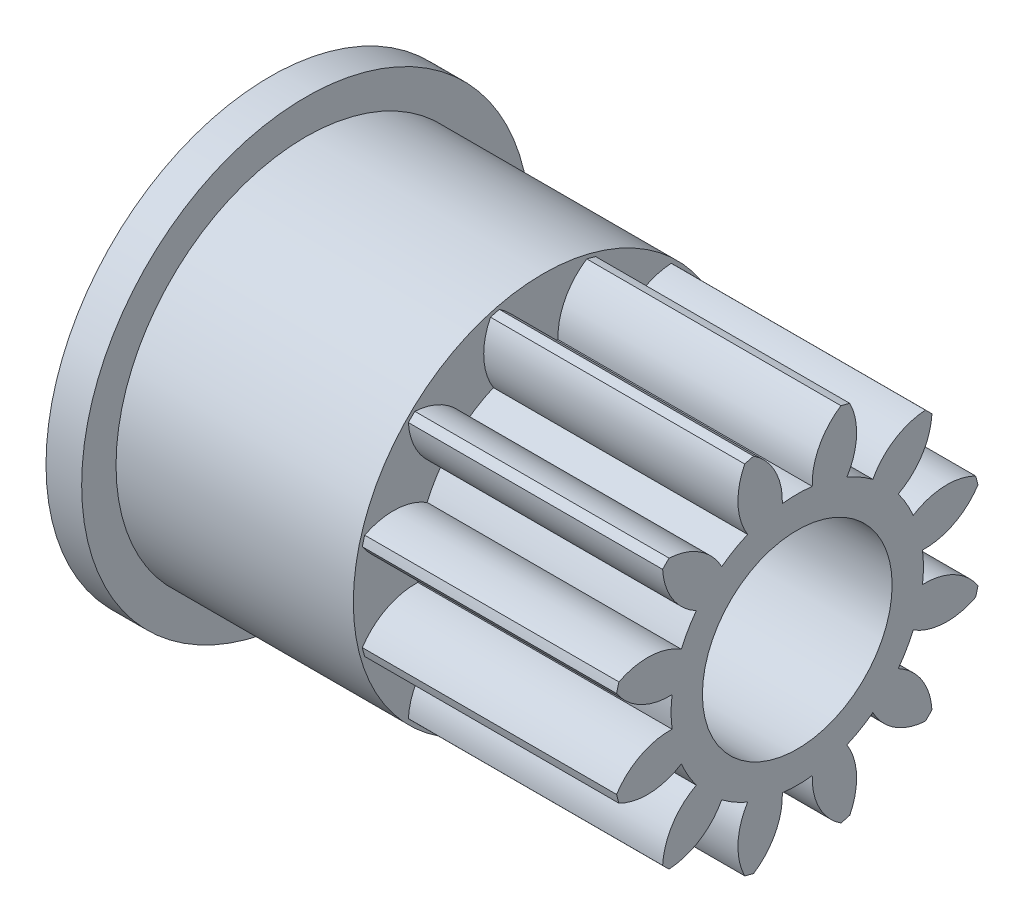
from build123d import *

# Parameters (mm, degrees)
BASPROSKE_W         = 6.7
BASPROSKE_H         = 4.9
TOOTHCUT_DEPTH      = 10.638983349
TEETHCUTS_COUNT     = 12
TEETHCUTS_ANGLE     = 330
BORSKE_R            = 0.4
BORE_DEPTH          = 50.0000508
SKETCH1_R           = 5
BOSS_EXTRUDE1_DEPTH = 7.1938
SKETCH3_R           = 5.9055
BOSS_EXTRUDE2_DEPTH = 0.9398
SKETCH2_R           = 2.5
CUT_EXTRUDE1_DEPTH  = 17.210722962


with BuildPart() as part:
    # BasProSke → Base-Revolve (revolve)
    with BuildSketch(Plane(origin=(0, 0, 0), x_dir=(1, 0, 0), z_dir=(0, 1, 0)), mode=Mode.PRIVATE) as base_revolve_sk:
        with Locations((3.35, 2.45)):
            Rectangle(BASPROSKE_W, BASPROSKE_H)
    revolve(base_revolve_sk.sketch.rotate(Axis((-10, 0, 0), (1, 0, 0)), 180), axis=Axis((-10, 0, 0), (1, 0, 0)))

    # TooCutSke → ToothCut (cut, through all)
    with BuildSketch(Plane(origin=(0, 0, 0), x_dir=(0, 0, -1), z_dir=(1, 0, 0))):
        with BuildLine():
            ThreePointArc((0.394109641, 3.300553528), (0, 3.324), (-0.394109641, 3.300553528))
            ThreePointArc((-0.394109641, 3.300553528), (-0.589367544, 4.146348526), (-1.180740601, 4.781779668))
            ThreePointArc((-1.180740601, 4.781779668), (0, 4.9254), (1.180740601, 4.781779668))
            ThreePointArc((1.180740601, 4.781779668), (0.589367544, 4.146348526), (0.394109641, 3.300553528))
        make_face()
    toothcut = extrude(amount=TOOTHCUT_DEPTH, mode=Mode.SUBTRACT)

    # TeethCuts: ToothCut ×12 about axis
    teethcuts_axis = Axis((-10, 0, 0), (1, 0, 0))
    for i in range(1, TEETHCUTS_COUNT):
        add(toothcut.rotate(teethcuts_axis, i * TEETHCUTS_ANGLE / (TEETHCUTS_COUNT - 1)), mode=Mode.SUBTRACT)

    # BorSke → Bore (cut, symmetric)
    with BuildSketch(Plane(origin=(0, 0, 0), x_dir=(0, 0, -1), z_dir=(1, 0, 0))):
        with Locations(Location((0, 0, 0), (0, 0, 180))):
            Circle(BORSKE_R)
    extrude(amount=BORE_DEPTH, both=True, mode=Mode.SUBTRACT)

    # Sketch1 → Boss-Extrude1 (add)
    with BuildSketch(Plane.ZY):
        Circle(SKETCH1_R)
    extrude(amount=BOSS_EXTRUDE1_DEPTH)

    # Sketch3 → Boss-Extrude2 (add)
    with BuildSketch(Plane.ZY.offset(7.1938)):
        Circle(SKETCH3_R)
    extrude(amount=-BOSS_EXTRUDE2_DEPTH)

    # Sketch2 → Cut-Extrude1 (cut, through all)
    with BuildSketch(Plane.ZY.offset(7.1938)):
        Circle(SKETCH2_R)
    extrude(amount=-CUT_EXTRUDE1_DEPTH, mode=Mode.SUBTRACT)


solid = part.part
